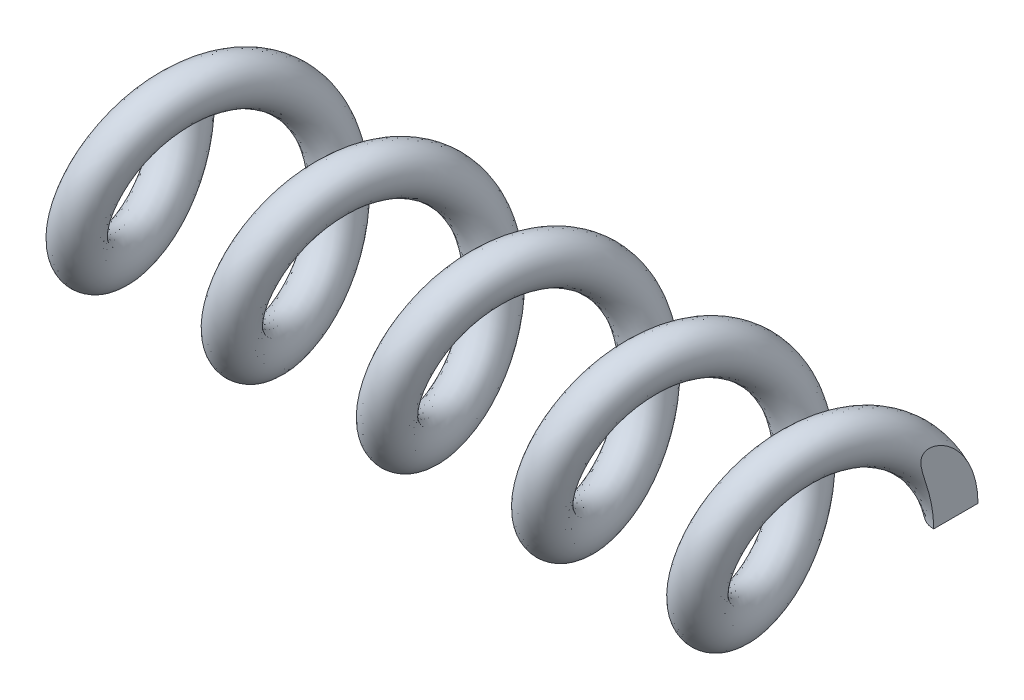
from build123d import *

# Parameters (mm, degrees)
SWEEP1_PITCH       = 7
SWEEP1_HEIGHT      = 35
SWEEP1_RADIUS      = 4
SWEEP1_START_ANGLE = 180
SKETCH2_R          = 1
SKETCH3_W          = 5.882080184
SKETCH3_H          = 11.517844516
CUT_EXTRUDE1_DEPTH = 10
SKETCH4_W          = 3.261207621
SKETCH4_H          = 7.040096259
CUT_EXTRUDE2_DEPTH = 10


with BuildPart() as part:
    # Sweep1: sweep along a helix
    with BuildLine() as sweep1_path:
        add(Helix(SWEEP1_PITCH, SWEEP1_HEIGHT, SWEEP1_RADIUS, center=(0, 0, 0), direction=(1, 0, 0), lefthand=True, mode=Mode.PRIVATE).rotate(Axis((0, 0, 0), (1, 0, 0)), SWEEP1_START_ANGLE))
    # Sketch2 → Sweep1 (sweep)
    with BuildSketch(Plane(origin=(0, 0, 0), x_dir=(1, 0, 0), z_dir=(0, 1, 0))):
        with Locations((0, 4)):
            Circle(SKETCH2_R)
    sweep(path=sweep1_path.line, is_frenet=True)

    # Sketch3 → Cut-Extrude1 (cut)
    with BuildSketch(Plane(origin=(0, 0, 0), x_dir=(1, 0, 0), z_dir=(0, 1, 0))):
        with Locations((-2.941040092, -0.758922258)):
            Rectangle(SKETCH3_W, SKETCH3_H)
    extrude(amount=-CUT_EXTRUDE1_DEPTH, mode=Mode.SUBTRACT)

    # Sketch4 → Cut-Extrude2 (cut)
    with BuildSketch(Plane.XZ):
        with Locations((36.630603811, -1.47995187)):
            Rectangle(SKETCH4_W, SKETCH4_H)
    extrude(amount=-CUT_EXTRUDE2_DEPTH, mode=Mode.SUBTRACT)


solid = part.part
